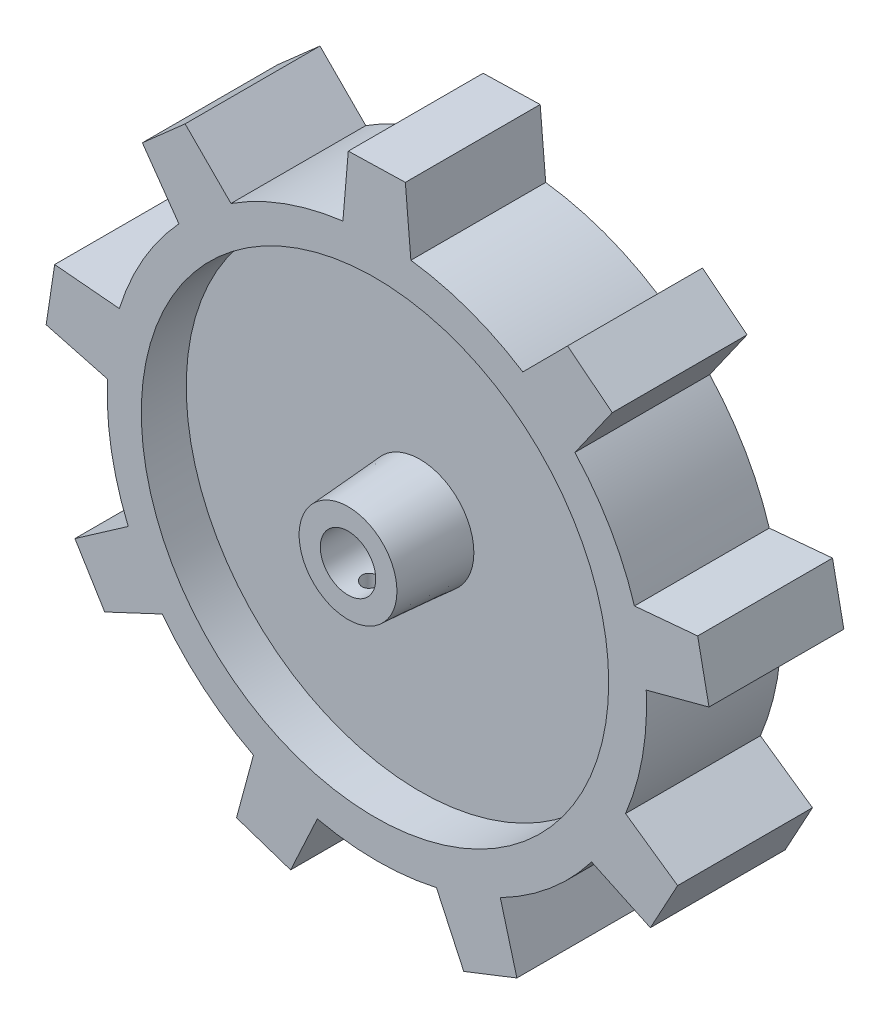
from build123d import *

# Parameters (mm, degrees)
BOSS_EXTRUDE1_DEPTH = 15
SKETCH3_R           = 26
CUT_EXTRUDE1_DEPTH  = 5
CUT_EXTRUDE2_START  = -5
SKETCH4_R           = 26
CUT_EXTRUDE2_DEPTH  = 5
SKETCH5_R           = 6
BOSS_EXTRUDE2_DEPTH = 8
BOSS_EXTRUDE2_TAPER = 4
SKETCH6_R           = 6
BOSS_EXTRUDE3_DEPTH = 5
SKETCH7_R           = 3.084221082
CUT_EXTRUDE3_DEPTH  = 12
CUT_EXTRUDE4_REACH  = 57.352
SKETCH8_R           = 1


with BuildPart() as part:
    # Sketch1 → Boss-Extrude1 (new body)
    with BuildSketch(Plane.XY):
        with BuildLine():
            Line((-3.570594462, 29.667493479), (-2.97005784, 36.705576615))
            Line((-2.97005784, 36.705576615), (3.376008048, 36.866330498))
            Line((3.376008048, 36.866330498), (3.990261273, 29.667493478))
            ThreePointArc((3.990261273, 29.667493478), (10.470437707, 28.097419204), (16.443765143, 25.134788755))
            Line((16.443765143, 25.134788755), (21.427795521, 30.140255732))
            Line((21.427795521, 30.140255732), (26.392494634, 26.184227828))
            Line((26.392494634, 26.184227828), (22.235716663, 20.274764369))
            ThreePointArc((22.235716663, 20.274764369), (26.190595521, 14.906640576), (28.862087666, 8.797553119))
            Line((28.862087666, 8.797553119), (35.897528594, 9.428290308))
            Line((35.897528594, 9.428290308), (37.157823041, 3.20655004))
            Line((37.157823041, 3.20655004), (30.175016484, 1.351563771))
            ThreePointArc((30.175016484, 1.351563771), (29.754065995, -5.302804758), (27.873701984, -11.699839306))
            Line((27.873701984, -11.699839306), (33.668592462, -15.738960845))
            Line((33.668592462, -15.738960845), (30.634776465, -21.315192059))
            Line((30.634776465, -21.315192059), (24.093274115, -18.247732447))
            ThreePointArc((24.093274115, -18.247732447), (19.493461691, -23.074692722), (13.941084742, -26.766430803))
            Line((13.941084742, -26.766430803), (15.783931113, -33.585461212))
            Line((15.783931113, -33.585461212), (9.875560893, -35.907002814))
            Line((9.875560893, -35.907002814), (6.8362044, -29.352395764))
            ThreePointArc((6.8362044, -29.352395764), (0.209833396, -30.093359427), (-6.416537607, -29.352395762))
            Line((-6.416537607, -29.352395762), (-9.388023643, -35.760634927))
            Line((-9.388023643, -35.760634927), (-15.406355994, -33.741211801))
            Line((-15.406355994, -33.741211801), (-13.521417949, -26.766430798))
            ThreePointArc((-13.521417949, -26.766430798), (-19.073794896, -23.074692716), (-23.673607318, -18.24773244))
            Line((-23.673607318, -18.24773244), (-30.069034419, -21.246694037))
            Line((-30.069034419, -21.246694037), (-33.381284309, -15.831216706))
            Line((-33.381284309, -15.831216706), (-27.454035185, -11.699839298))
            ThreePointArc((-27.454035185, -11.699839298), (-29.334399194, -5.302804748), (-29.755349682, 1.351563781))
            Line((-29.755349682, 1.351563781), (-36.58222643, 3.165127213))
            Line((-36.58222643, 3.165127213), (-35.638555324, 9.442696719))
            Line((-35.638555324, 9.442696719), (-28.442420861, 8.797553128))
            ThreePointArc((-28.442420861, 8.797553128), (-25.770928714, 14.906640584), (-21.816049855, 20.274764376))
            Line((-21.816049855, 20.274764376), (-25.880004748, 26.052266352))
            Line((-25.880004748, 26.052266352), (-21.121966844, 30.254583494))
            Line((-21.121966844, 30.254583494), (-16.024098333, 25.13478876))
            ThreePointArc((-16.024098333, 25.13478876), (-10.050770896, 28.097419207), (-3.570594462, 29.667493479))
        make_face()
    extrude(amount=BOSS_EXTRUDE1_DEPTH)

    # Sketch3 → Cut-Extrude1 (cut)
    with BuildSketch(Plane.XY.offset(15)):
        Circle(SKETCH3_R)
    extrude(amount=-CUT_EXTRUDE1_DEPTH, mode=Mode.SUBTRACT)

    # Sketch4 → Cut-Extrude2 (cut)
    with BuildSketch(Plane(origin=(0, 0, 0), x_dir=(-1, 0, 0), z_dir=(0, 0, -1)).offset(CUT_EXTRUDE2_START)):
        with Locations(Location((0, 0, 0), (0, 0, 180))):
            Circle(SKETCH4_R)
    extrude(amount=CUT_EXTRUDE2_DEPTH, mode=Mode.SUBTRACT)

    # Sketch5 → Boss-Extrude2 (add)
    with BuildSketch(Plane.XY.offset(10)):
        Circle(SKETCH5_R)
    extrude(amount=BOSS_EXTRUDE2_DEPTH, taper=BOSS_EXTRUDE2_TAPER)

    # Sketch6 → Boss-Extrude3 (add)
    with BuildSketch(Plane(origin=(0, 0, 5), x_dir=(-1, 0, 0), z_dir=(0, 0, -1))):
        Circle(SKETCH6_R)
    extrude(amount=BOSS_EXTRUDE3_DEPTH)

    # Sketch7 → Cut-Extrude3 (cut)
    with BuildSketch(Plane.XY.offset(18)):
        Circle(SKETCH7_R)
    extrude(amount=-CUT_EXTRUDE3_DEPTH, mode=Mode.SUBTRACT)

    # Cut-Extrude4: up to this cone (the profile starts inside it)
    cut_extrude4_end = Plane(origin=(0, 0, 15.4184), z_dir=(0, 0, -1)) * Cone(1.182636436, 10.059580688, 126.946217124, mode=Mode.PRIVATE)
    # Sketch8 → Cut-Extrude4 (cut, up to the surface)
    with BuildSketch(Plane(origin=(0, 0, 0), x_dir=(1, 0, 0), z_dir=(0, 1, 0)), mode=Mode.PRIVATE) as cut_extrude4_sk1:
        with Locations(Location((0, -15.418399821, 0), (0, 0, 270))):
            Circle(SKETCH8_R)
    cut_extrude4_tool1 = extrude(cut_extrude4_sk1.sketch, amount=-CUT_EXTRUDE4_REACH, mode=Mode.PRIVATE) & cut_extrude4_end
    add(cut_extrude4_tool1.solids().sort_by_distance((0, 0, 15.4184))[0], mode=Mode.SUBTRACT)


solid = part.part
